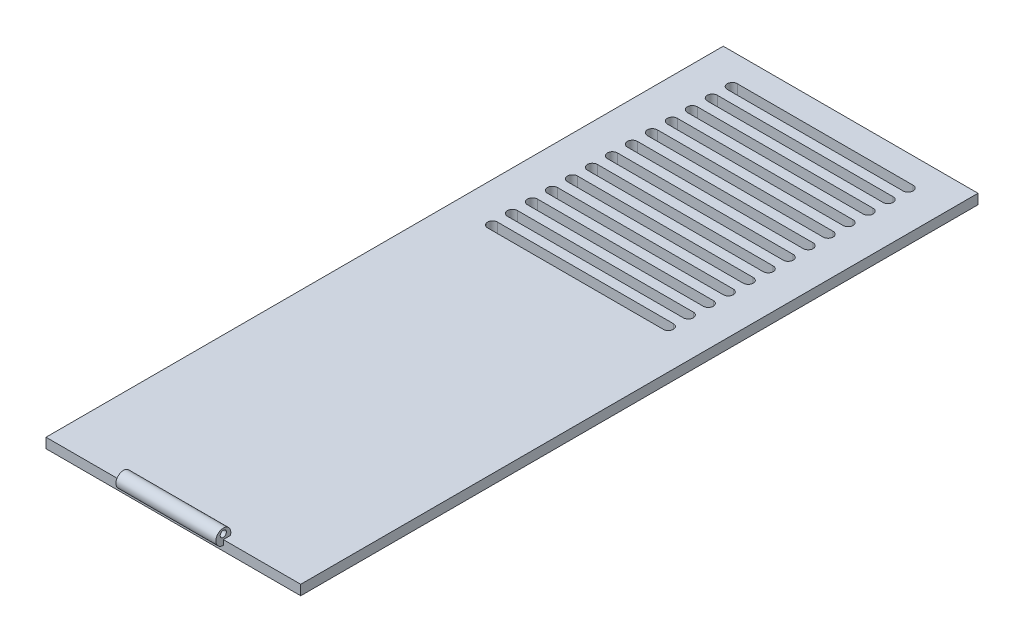
from build123d import *

# Parameters (mm, degrees)
SKETCH1_W                = 51
SKETCH1_H                = 136
BOSS_EXTRUDE1_DEPTH      = 2
CUT_EXTRUDE1_DEPTH       = 10
SKETCH5_W                = 1
SKETCH5_H                = 2
BOSS_EXTRUDE2_DEPTH      = 136
SKETCH6_W                = 1
SKETCH6_H                = 2
BOSS_EXTRUDE3_DEPTH      = 136
SKETCH7_W                = 68.795835126
SKETCH7_H                = 26.425628728
CUT_EXTRUDE2_DEPTH       = 0.4
SKETCH8_W                = 2
SKETCH8_H                = 2
CUT_EXTRUDE3_DEPTH       = 135.6
BOSS_EXTRUDE6_DEPTH      = 10
BOSS_EXTRUDE6_DEPTH_BACK = 10
SKETCH11_R               = 1.5
SKETCH14_R               = 0.62
CUT_EXTRUDE5_DEPTH       = 20


with BuildPart() as part:
    # Sketch1 → Boss-Extrude1 (new body)
    with BuildSketch(Plane(origin=(0, 0, 0), x_dir=(1, 0, 0), z_dir=(0, 1, 0))):
        with Locations((-30.5, -4.545454545)):
            Rectangle(SKETCH1_W, SKETCH1_H)
    extrude(amount=BOSS_EXTRUDE1_DEPTH)

    # Sketch4 → Cut-Extrude1 (cut)
    with BuildSketch(Plane(origin=(0, 2, 0), x_dir=(1, 0, 0), z_dir=(0, 1, 0))):
        with BuildLine():
            Line((-48.1, 58.354545455), (-12.9, 58.354545455))
            ThreePointArc((-12.9, 58.354545455), (-11.9, 57.354545455), (-12.9, 56.354545455))
            Line((-12.9, 56.354545455), (-48.1, 56.354545455))
            ThreePointArc((-48.1, 56.354545455), (-49.1, 57.354545455), (-48.1, 58.354545455))
        make_face()
        with BuildLine():
            Line((-48.1, 54.354545455), (-12.9, 54.354545455))
            ThreePointArc((-12.9, 54.354545455), (-11.9, 53.354545455), (-12.9, 52.354545455))
            Line((-12.9, 52.354545455), (-48.1, 52.354545455))
            ThreePointArc((-48.1, 52.354545455), (-49.1, 53.354545455), (-48.1, 54.354545455))
        make_face()
        with BuildLine():
            Line((-48.1, 50.354545455), (-12.9, 50.354545455))
            ThreePointArc((-12.9, 50.354545455), (-11.9, 49.354545455), (-12.9, 48.354545455))
            Line((-12.9, 48.354545455), (-48.1, 48.354545455))
            ThreePointArc((-48.1, 48.354545455), (-49.1, 49.354545455), (-48.1, 50.354545455))
        make_face()
        with BuildLine():
            Line((-48.1, 46.354545455), (-12.9, 46.354545455))
            ThreePointArc((-12.9, 46.354545455), (-11.9, 45.354545455), (-12.9, 44.354545455))
            Line((-12.9, 44.354545455), (-48.1, 44.354545455))
            ThreePointArc((-48.1, 44.354545455), (-49.1, 45.354545455), (-48.1, 46.354545455))
        make_face()
        with BuildLine():
            Line((-48.1, 42.354545455), (-12.9, 42.354545455))
            ThreePointArc((-12.9, 42.354545455), (-11.9, 41.354545455), (-12.9, 40.354545455))
            Line((-12.9, 40.354545455), (-48.1, 40.354545455))
            ThreePointArc((-48.1, 40.354545455), (-49.1, 41.354545455), (-48.1, 42.354545455))
        make_face()
        with BuildLine():
            Line((-48.1, 38.354545455), (-12.9, 38.354545455))
            ThreePointArc((-12.9, 38.354545455), (-11.9, 37.354545455), (-12.9, 36.354545455))
            Line((-12.9, 36.354545455), (-48.1, 36.354545455))
            ThreePointArc((-48.1, 36.354545455), (-49.1, 37.354545455), (-48.1, 38.354545455))
        make_face()
        with BuildLine():
            Line((-48.1, 34.354545455), (-12.9, 34.354545455))
            ThreePointArc((-12.9, 34.354545455), (-11.9, 33.354545455), (-12.9, 32.354545455))
            Line((-12.9, 32.354545455), (-48.1, 32.354545455))
            ThreePointArc((-48.1, 32.354545455), (-49.1, 33.354545455), (-48.1, 34.354545455))
        make_face()
        with BuildLine():
            Line((-48.1, 30.354545455), (-12.9, 30.354545455))
            ThreePointArc((-12.9, 30.354545455), (-11.9, 29.354545455), (-12.9, 28.354545455))
            Line((-12.9, 28.354545455), (-48.1, 28.354545455))
            ThreePointArc((-48.1, 28.354545455), (-49.1, 29.354545455), (-48.1, 30.354545455))
        make_face()
        with BuildLine():
            Line((-48.1, 26.354545455), (-12.9, 26.354545455))
            ThreePointArc((-12.9, 26.354545455), (-11.9, 25.354545455), (-12.9, 24.354545455))
            Line((-12.9, 24.354545455), (-48.1, 24.354545455))
            ThreePointArc((-48.1, 24.354545455), (-49.1, 25.354545455), (-48.1, 26.354545455))
        make_face()
        with BuildLine():
            Line((-48.1, 22.354545455), (-12.9, 22.354545455))
            ThreePointArc((-12.9, 22.354545455), (-11.9, 21.354545455), (-12.9, 20.354545455))
            Line((-12.9, 20.354545455), (-48.1, 20.354545455))
            ThreePointArc((-48.1, 20.354545455), (-49.1, 21.354545455), (-48.1, 22.354545455))
        make_face()
        with BuildLine():
            Line((-48.1, 18.354545455), (-12.9, 18.354545455))
            ThreePointArc((-12.9, 18.354545455), (-11.9, 17.354545455), (-12.9, 16.354545455))
            Line((-12.9, 16.354545455), (-48.1, 16.354545455))
            ThreePointArc((-48.1, 16.354545455), (-49.1, 17.354545455), (-48.1, 18.354545455))
        make_face()
        with BuildLine():
            Line((-48.1, 14.354545455), (-12.9, 14.354545455))
            ThreePointArc((-12.9, 14.354545455), (-11.9, 13.354545455), (-12.9, 12.354545455))
            Line((-12.9, 12.354545455), (-48.1, 12.354545455))
            ThreePointArc((-48.1, 12.354545455), (-49.1, 13.354545455), (-48.1, 14.354545455))
        make_face()
        with BuildLine():
            Line((-48.1, 10.354545455), (-12.9, 10.354545455))
            ThreePointArc((-12.9, 10.354545455), (-11.9, 9.354545455), (-12.9, 8.354545455))
            Line((-12.9, 8.354545455), (-48.1, 8.354545455))
            ThreePointArc((-48.1, 8.354545455), (-49.1, 9.354545455), (-48.1, 10.354545455))
        make_face()
    extrude(amount=-CUT_EXTRUDE1_DEPTH, mode=Mode.SUBTRACT)

    # Sketch5 → Boss-Extrude2 (add)
    with BuildSketch(Plane(origin=(0, 0, -63.454545455), x_dir=(-1, 0, 0), z_dir=(0, 0, -1))):
        with Locations((56.5, 1)):
            Rectangle(SKETCH5_W, SKETCH5_H)
        with Locations((4.5, 1)):
            Rectangle(SKETCH5_W, SKETCH5_H)
    extrude(amount=-BOSS_EXTRUDE2_DEPTH)

    # Sketch6 → Boss-Extrude3 (add)
    with BuildSketch(Plane(origin=(0, 0, -63.454545455), x_dir=(-1, 0, 0), z_dir=(0, 0, -1))):
        with Locations((57.5, 1)):
            Rectangle(SKETCH6_W, SKETCH6_H)
        with Locations((3.5, 1)):
            Rectangle(SKETCH6_W, SKETCH6_H)
    extrude(amount=-BOSS_EXTRUDE3_DEPTH)

    # Sketch7 → Cut-Extrude2 (cut)
    with BuildSketch(Plane.XY.offset(72.545454545)):
        with Locations((-32.339758962, -3.400766566)):
            Rectangle(SKETCH7_W, SKETCH7_H)
    extrude(amount=-CUT_EXTRUDE2_DEPTH, mode=Mode.SUBTRACT)

    # Sketch8 → Cut-Extrude3 (cut)
    with BuildSketch(Plane(origin=(0, 0, -63.454545455), x_dir=(-1, 0, 0), z_dir=(0, 0, -1))):
        with Locations((4, 1)):
            Rectangle(SKETCH8_W, SKETCH8_H)
        with Locations((57, 1)):
            Rectangle(SKETCH8_W, SKETCH8_H)
    extrude(amount=-CUT_EXTRUDE3_DEPTH, mode=Mode.SUBTRACT)

    # Sketch11 → Boss-Extrude6 (add, two sides: drawn at the far end of the back side and taken through both)
    with BuildSketch(Plane.ZY.offset(30.5).offset(-BOSS_EXTRUDE6_DEPTH_BACK)):
        with Locations((72.145454545, 2.5)):
            Circle(SKETCH11_R)
    extrude(amount=BOSS_EXTRUDE6_DEPTH + BOSS_EXTRUDE6_DEPTH_BACK)

    # Sketch14 → Cut-Extrude5 (cut)
    with BuildSketch(Plane.ZY.offset(40.5)):
        with Locations(Location((72.145454545, 3, 0), (0, 0, 270))):
            Circle(SKETCH14_R)
    extrude(amount=-CUT_EXTRUDE5_DEPTH, mode=Mode.SUBTRACT)


solid = part.part
